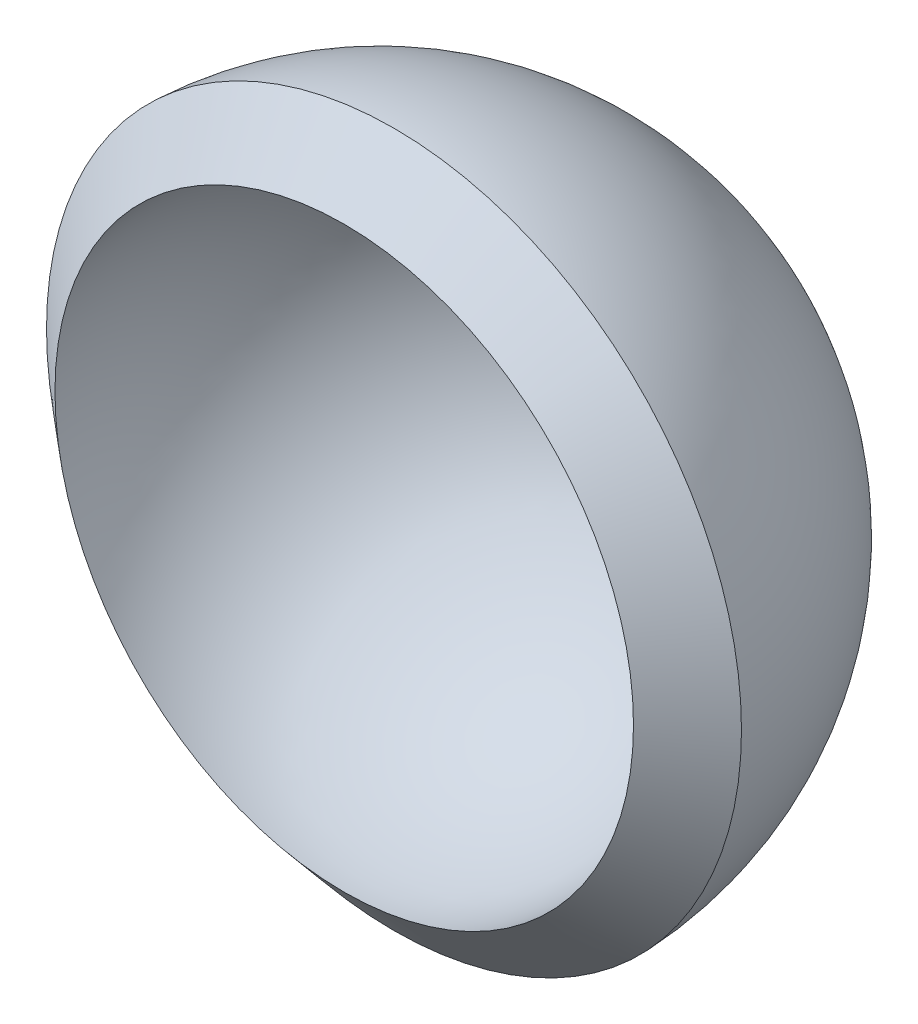
from build123d import *


with BuildPart() as part:
    # Sketch1 → Revolve1 (revolve)
    with BuildSketch(Plane(origin=(0, 0, 0), x_dir=(1, 0, 0), z_dir=(0, 1, 0))):
        with BuildLine():
            Line((2.977717522, 11.965036496), (3.576963888, 12.477408759))
            ThreePointArc((3.576963888, 12.477408759), (2.478777586, 14.913033426), (0, 15.91))
            Line((0, 15.91), (0, 15.33))
            ThreePointArc((0, 15.33), (2.24665201, 14.318103303), (2.977717522, 11.965036496))
        make_face()
    revolve(axis=Axis((0, 0, -16.260021103), (0, 0, 1)))


solid = part.part
